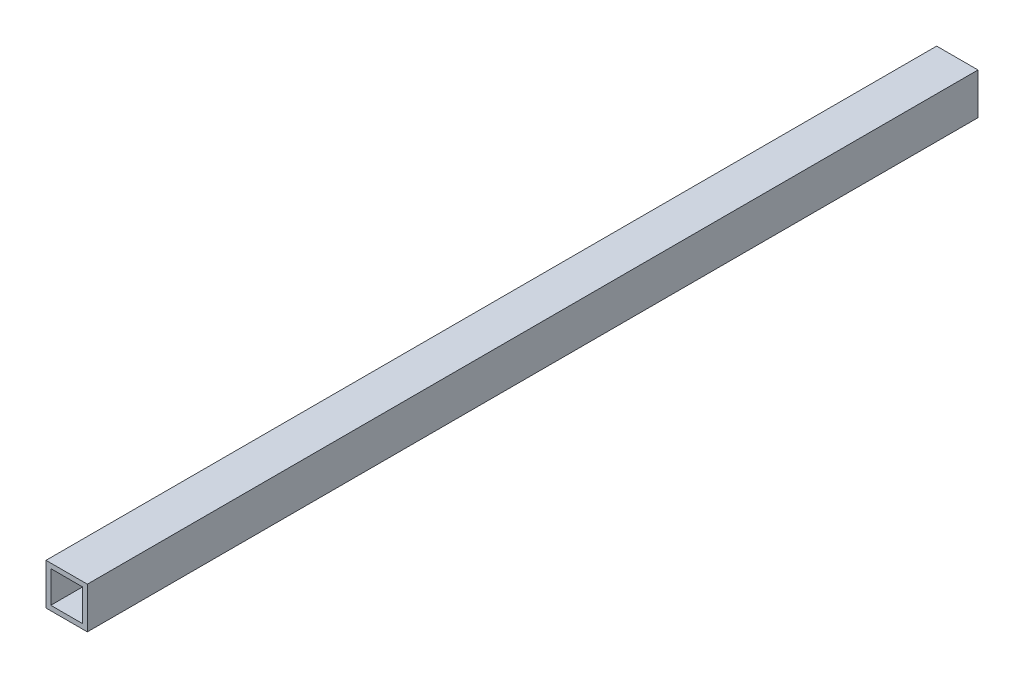
from build123d import *

# Parameters (mm, degrees)
SKETCH1_W           = 13
SKETCH1_H           = 13
SKETCH1_W_2         = 10
SKETCH1_H_2         = 10
BOSS_EXTRUDE1_DEPTH = 280


with BuildPart() as part:
    # Sketch1 → Boss-Extrude1 (new body)
    with BuildSketch(Plane.XY):
        Rectangle(SKETCH1_W, SKETCH1_H)
        Rectangle(SKETCH1_W_2, SKETCH1_H_2, mode=Mode.SUBTRACT)
    extrude(amount=BOSS_EXTRUDE1_DEPTH)


solid = part.part
